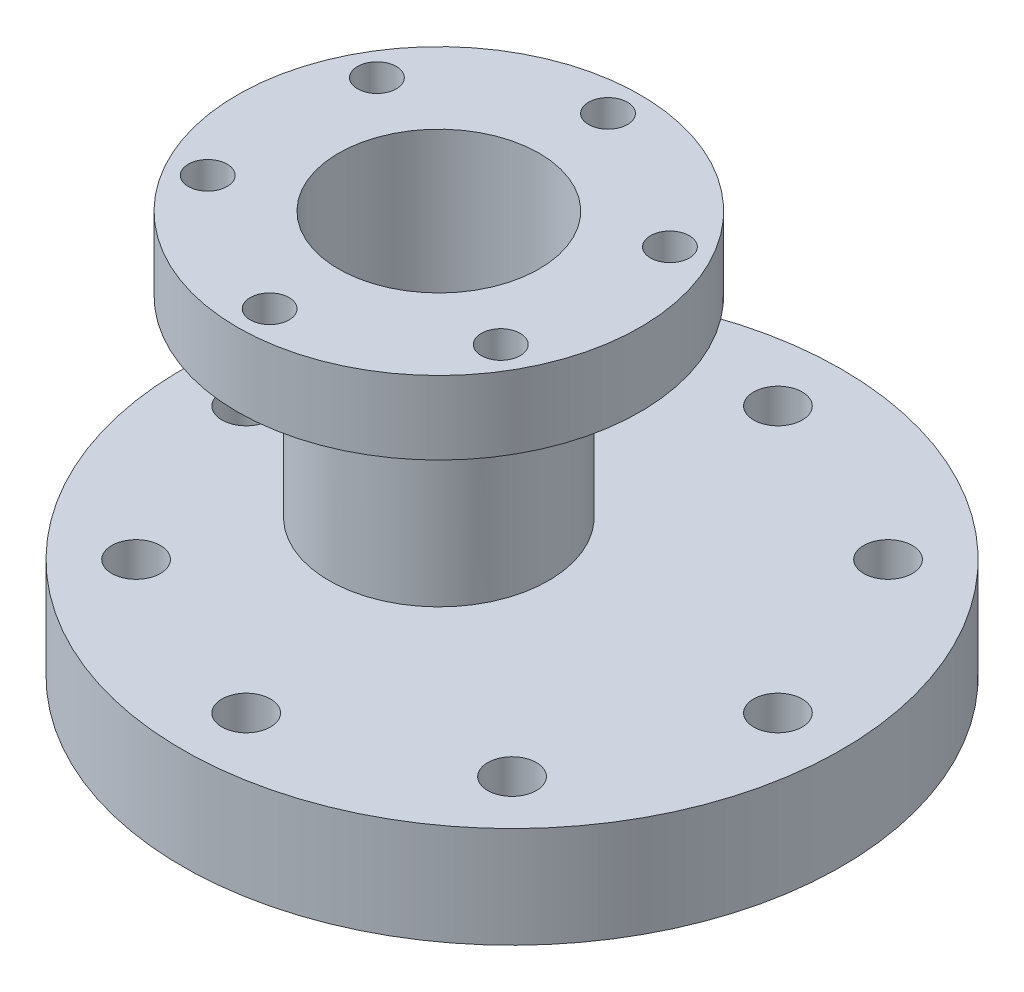
from build123d import *

# Parameters (mm, degrees)
SKETCH1_R               = 19.05
EXTRUDE1_DEPTH          = 16.637
SKETCH4_R               = 34.925
EXTRUDE2_DEPTH          = 12.7
SKETCH6_R               = 57.15
EXTRUDE3_DEPTH          = 17.526
CUT_EXTRUDE1_DEPTH      = 102.285505755
CUT_EXTRUDE1_DEPTH_BACK = 102.285505755
SKETCH7_R               = 17.399
SKETCH8_R               = 3.3655
CUT_EXTRUDE2_DEPTH      = 12.7
CIRPATTERN1_COUNT       = 6
SKETCH9_R               = 4.2164
CUT_EXTRUDE3_DEPTH      = 17.526
CIRPATTERN2_COUNT       = 8


with BuildPart() as part:
    # Sketch1 → Extrude1 (new, symmetric)
    with BuildSketch(Plane(origin=(0, 0, 0), x_dir=(1, 0, 0), z_dir=(0, 1, 0))):
        Circle(SKETCH1_R)
    extrude(amount=EXTRUDE1_DEPTH, both=True)

    # Sketch4 → Extrude2 (add)
    with BuildSketch(Plane(origin=(0, 16.637, 0), x_dir=(-1, 0, 0), z_dir=(0, 1, 0))):
        Circle(SKETCH4_R)
    extrude(amount=EXTRUDE2_DEPTH)

    # Sketch6 → Extrude3 (add)
    with BuildSketch(Plane.XZ.offset(16.637)):
        with Locations((12.7, 0)):
            Circle(SKETCH6_R)
    extrude(amount=EXTRUDE3_DEPTH)

    # Sketch7 → Cut-Extrude1 (cut, two sides: drawn at the far end of the back side and taken through both)
    with BuildSketch(Plane.XZ.offset(16.637).offset(-CUT_EXTRUDE1_DEPTH_BACK)):
        Circle(SKETCH7_R)
    extrude(amount=CUT_EXTRUDE1_DEPTH + CUT_EXTRUDE1_DEPTH_BACK, mode=Mode.SUBTRACT)

    # Sketch8 → Cut-Extrude2 (cut)
    with BuildSketch(Plane(origin=(0, 16.637, 0), x_dir=(-1, 0, 0), z_dir=(0, 1, 0))):
        with Locations((0, 29.337)):
            Circle(SKETCH8_R)
    cut_extrude2 = extrude(amount=CUT_EXTRUDE2_DEPTH, mode=Mode.SUBTRACT)

    # CirPattern1: Cut-Extrude2 ×6 about axis
    cirpattern1_axis = Axis((0, 69.04565356, 0), (0, -1, 0))
    for i in range(1, CIRPATTERN1_COUNT):
        add(cut_extrude2.rotate(cirpattern1_axis, i * 360 / CIRPATTERN1_COUNT), mode=Mode.SUBTRACT)

    # Sketch9 → Cut-Extrude3 (cut)
    with BuildSketch(Plane.XZ.offset(16.637)):
        with Locations((12.7, 46.101)):
            Circle(SKETCH9_R)
    cut_extrude3 = extrude(amount=CUT_EXTRUDE3_DEPTH, mode=Mode.SUBTRACT)

    # CirPattern2: Cut-Extrude3 ×8 about axis
    cirpattern2_axis = Axis((12.7, -85.68265356, 0), (0, 1, 0))
    for i in range(1, CIRPATTERN2_COUNT):
        add(cut_extrude3.rotate(cirpattern2_axis, i * 360 / CIRPATTERN2_COUNT), mode=Mode.SUBTRACT)


solid = part.part
